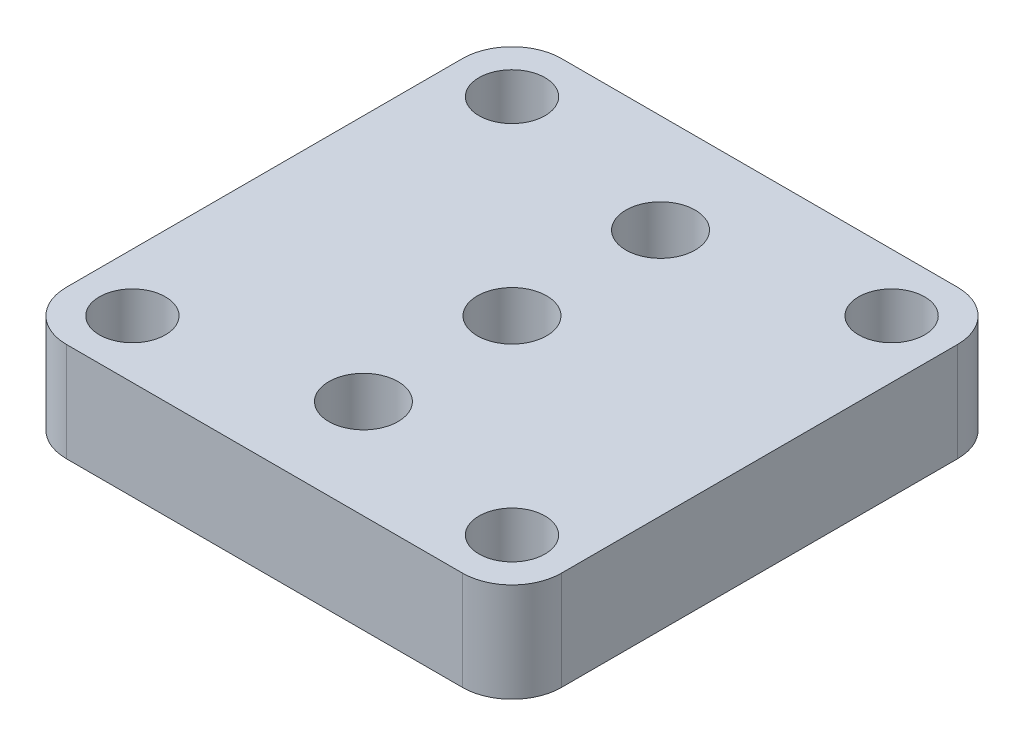
from build123d import *

# Parameters (mm, degrees)
BOSS_EXTRUDE1_DEPTH          = 6
M5X0_8_TAPPED_HOLE1_D        = 4.2
F_4_0_4_DIAMETER_HOLE1_D     = 4
F_4_0_4_DIAMETER_HOLE1_DEPTH = 10
F_4_0_4_DIAMETER_HOLE1_TIP   = 1.201721238


with BuildPart() as part:
    # Sketch2 → Boss-Extrude1 (new body)
    with BuildSketch(Plane(origin=(0, 0, 0), x_dir=(1, 0, 0), z_dir=(0, 1, 0))):
        with BuildLine():
            Line((-12, -15), (12, -15))
            ThreePointArc((12, -15), (14.121320344, -14.121320344), (15, -12))
            Line((15, -12), (15, 12))
            ThreePointArc((15, 12), (14.121320344, 14.121320344), (12, 15))
            Line((12, 15), (-12, 15))
            ThreePointArc((-12, 15), (-14.121320344, 14.121320344), (-15, 12))
            Line((-15, 12), (-15, -12))
            ThreePointArc((-15, -12), (-14.121320344, -14.121320344), (-12, -15))
        make_face()
    extrude(amount=-BOSS_EXTRUDE1_DEPTH)

    # M5x0.8 Tapped Hole1 (through all)
    with Locations(Plane(origin=(0, 0, 0), x_dir=(1, 0, 0), z_dir=(0, 1, 0))):
        with Locations((0, 0), (0, 9), (0, -9)):
            Hole(M5X0_8_TAPPED_HOLE1_D / 2)

    # Ø4.0 (4) Diameter Hole1
    with Locations(Plane(origin=(0, 0, 0), x_dir=(1, 0, 0), z_dir=(0, 1, 0))):
        with Locations((-11.5, -11.5), (-11.5, 11.5), (11.5, 11.5), (11.5, -11.5)):
            Hole(F_4_0_4_DIAMETER_HOLE1_D / 2, depth=F_4_0_4_DIAMETER_HOLE1_DEPTH)
            with Locations((0, 0, -(F_4_0_4_DIAMETER_HOLE1_DEPTH + F_4_0_4_DIAMETER_HOLE1_TIP / 2))):  # 118° drill point
                Cone(0, F_4_0_4_DIAMETER_HOLE1_D / 2, F_4_0_4_DIAMETER_HOLE1_TIP, mode=Mode.SUBTRACT)


solid = part.part
